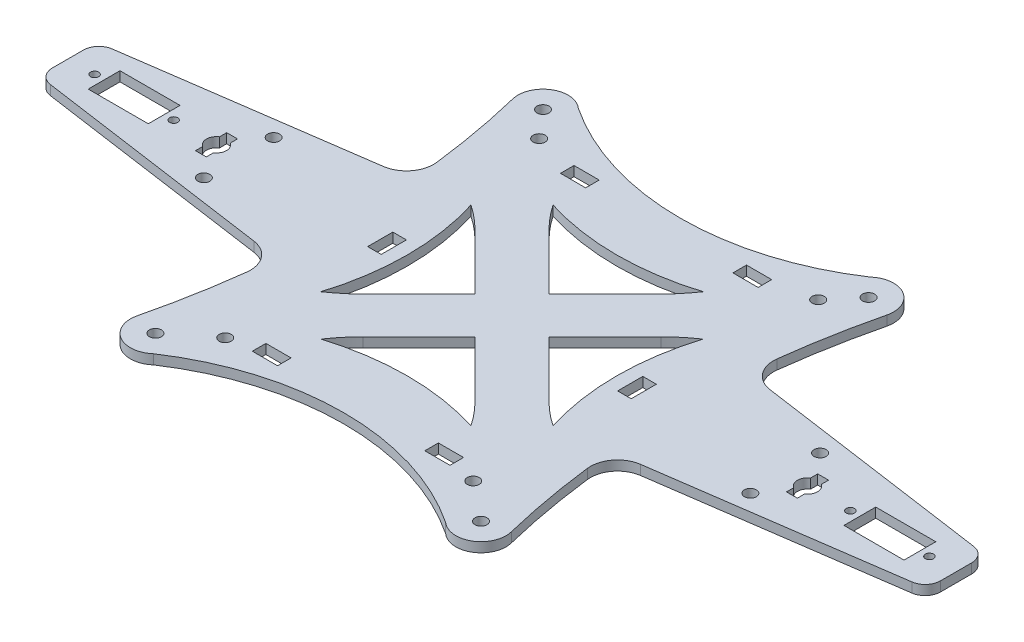
from build123d import *

# Parameters (mm, degrees)
SKETCH_1_R      = 1.55
SKETCH_1_R_2    = 1.05
SKETCH_1_W      = 6.5
SKETCH_1_H      = 3.5
SKETCH_1_W_2    = 3.5
SKETCH_1_H_2    = 6.5
SKETCH_1_W_3    = 15.5
SKETCH_1_H_3    = 8.2
EXTRUDE_1_DEPTH = 2.5
FILLET_1_R      = 4
FILLET_2_R      = 7


with BuildPart() as part:
    # 草图1 → 凸台-拉伸1 (new body)
    with BuildSketch(Plane(origin=(0, 0, 0), x_dir=(1, 0, 0), z_dir=(0, 1, 0))):
        with BuildLine():
            Line((114.591143215, 7.468307572), (114.591143215, -7.468307572))
            Line((114.591143215, -7.468307572), (43.193640968, -17.646273029))
            ThreePointArc((43.193640968, -17.646273029), (45.143245402, -33.15226541), (48.27557779, -48.463217404))
            ThreePointArc((48.27557779, -48.463217404), (45.335063646, -55.533708325), (37.709796983, -54.831018053))
            ThreePointArc((37.709796983, -54.831018053), (0, -43.436211003), (-37.709796983, -54.831018053))
            ThreePointArc((-37.709796983, -54.831018053), (-45.335063646, -55.533708325), (-48.27557779, -48.463217404))
            ThreePointArc((-48.27557779, -48.463217404), (-45.143245402, -33.15226541), (-43.193640968, -17.646273029))
            Line((-43.193640968, -17.646273029), (-114.591143215, -7.468307572))
            Line((-114.591143215, -7.468307572), (-114.591143215, 7.468307572))
            Line((-114.591143215, 7.468307572), (-43.193640968, 17.646273029))
            ThreePointArc((-43.193640968, 17.646273029), (-45.143245402, 33.15226541), (-48.27557779, 48.463217404))
            ThreePointArc((-48.27557779, 48.463217404), (-45.335063646, 55.533708325), (-37.709796983, 54.831018053))
            ThreePointArc((-37.709796983, 54.831018053), (0, 43.436211003), (37.709796983, 54.831018053))
            ThreePointArc((37.709796983, 54.831018053), (45.335063646, 55.533708325), (48.27557779, 48.463217404))
            ThreePointArc((48.27557779, 48.463217404), (45.143245402, 33.15226541), (43.193640968, 17.646273029))
            Line((43.193640968, 17.646273029), (114.591143215, 7.468307572))
        make_face()
        with Locations(Location((-36, 43, 0), (0, 0, 270))):
            Circle(SKETCH_1_R, mode=Mode.SUBTRACT)
        with Locations(Location((-32, -42, 0), (0, 0, 270))):
            Circle(SKETCH_1_R, mode=Mode.SUBTRACT)
        with Locations(Location((32, -42, 0), (0, 0, 90))):
            Circle(SKETCH_1_R, mode=Mode.SUBTRACT)
        with Locations(Location((36, 43, 0), (0, 0, 90))):
            Circle(SKETCH_1_R, mode=Mode.SUBTRACT)
        with Locations(Location((42, 50, 0), (0, 0, 270))):
            Circle(SKETCH_1_R, mode=Mode.SUBTRACT)
        with Locations(Location((42, -50, 0), (0, 0, 90))):
            Circle(SKETCH_1_R, mode=Mode.SUBTRACT)
        with Locations(Location((-42, -50, 0), (0, 0, 270))):
            Circle(SKETCH_1_R, mode=Mode.SUBTRACT)
        with Locations(Location((-42, 50, 0), (0, 0, 90))):
            Circle(SKETCH_1_R, mode=Mode.SUBTRACT)
        with Locations(Location((107.7, 0, 0), (0, 0, 270))):
            Circle(SKETCH_1_R_2, mode=Mode.SUBTRACT)
        with Locations(Location((87.3, 0, 0), (0, 0, 270))):
            Circle(SKETCH_1_R_2, mode=Mode.SUBTRACT)
        with Locations(Location((-87.3, 0, 0), (0, 0, 90))):
            Circle(SKETCH_1_R_2, mode=Mode.SUBTRACT)
        with Locations(Location((-107.7, 0, 0), (0, 0, 90))):
            Circle(SKETCH_1_R_2, mode=Mode.SUBTRACT)
        with Locations(Location((70.5, 9, 0), (0, 0, 270))):
            Circle(SKETCH_1_R, mode=Mode.SUBTRACT)
        with Locations(Location((70.5, -9, 0), (0, 0, 90))):
            Circle(SKETCH_1_R, mode=Mode.SUBTRACT)
        with Locations(Location((-70.5, -9, 0), (0, 0, 270))):
            Circle(SKETCH_1_R, mode=Mode.SUBTRACT)
        with Locations(Location((-70.5, 9, 0), (0, 0, 90))):
            Circle(SKETCH_1_R, mode=Mode.SUBTRACT)
        with Locations((-22.25, 39.75)):
            Rectangle(SKETCH_1_W, SKETCH_1_H, mode=Mode.SUBTRACT)
        with Locations((-32.25, 0)):
            Rectangle(SKETCH_1_W_2, SKETCH_1_H_2, mode=Mode.SUBTRACT)
        with Locations((-22.25, -39.75)):
            Rectangle(SKETCH_1_W, SKETCH_1_H, mode=Mode.SUBTRACT)
        with Locations((22.25, 39.75)):
            Rectangle(SKETCH_1_W, SKETCH_1_H, mode=Mode.SUBTRACT)
        with Locations((22.25, -39.75)):
            Rectangle(SKETCH_1_W, SKETCH_1_H, mode=Mode.SUBTRACT)
        with Locations((32.25, 0)):
            Rectangle(SKETCH_1_W_2, SKETCH_1_H_2, mode=Mode.SUBTRACT)
        with BuildLine():
            Line((77.65, -2.176778405), (77.65, -4.025))
            Line((77.65, -4.025), (74.85, -4.025))
            Line((74.85, -4.025), (74.85, -2.176778405))
            ThreePointArc((74.85, -2.176778405), (73.661880176, 0), (74.85, 2.176778405))
            Line((74.85, 2.176778405), (74.85, 4.025))
            Line((74.85, 4.025), (77.65, 4.025))
            Line((77.65, 4.025), (77.65, 2.176778405))
            ThreePointArc((77.65, 2.176778405), (78.838119824, 0), (77.65, -2.176778405))
        make_face(mode=Mode.SUBTRACT)
        with Locations((97.5, 0)):
            Rectangle(SKETCH_1_W_3, SKETCH_1_H_3, mode=Mode.SUBTRACT)
        with Locations((-97.5, 0)):
            Rectangle(SKETCH_1_W_3, SKETCH_1_H_3, mode=Mode.SUBTRACT)
        with BuildLine():
            Line((-74.85, -2.176778405), (-74.85, -4.025))
            Line((-74.85, -4.025), (-77.65, -4.025))
            Line((-77.65, -4.025), (-77.65, -2.176778405))
            ThreePointArc((-77.65, -2.176778405), (-78.838119824, 0), (-77.65, 2.176778405))
            Line((-77.65, 2.176778405), (-77.65, 4.025))
            Line((-77.65, 4.025), (-74.85, 4.025))
            Line((-74.85, 4.025), (-74.85, 2.176778405))
            ThreePointArc((-74.85, 2.176778405), (-73.661880176, 0), (-74.85, -2.176778405))
        make_face(mode=Mode.SUBTRACT)
        with BuildLine():
            Line((-23.978041684, 14.429581723), (-9.54845996, 0))
            Line((-9.54845996, 0), (-23.978041684, -14.429581723))
            ThreePointArc((-23.978041684, -14.429581723), (-26.851664039, -17.042325553), (-29.960234119, -19.370614155))
            ThreePointArc((-29.960234119, -19.370614155), (-27.006361348, 0), (-29.960234119, 19.370614155))
            ThreePointArc((-29.960234119, 19.370614155), (-26.851664039, 17.042325553), (-23.978041684, 14.429581723))
        make_face(mode=Mode.SUBTRACT)
        with BuildLine():
            Line((14.429581723, 23.978041684), (0, 9.54845996))
            Line((0, 9.54845996), (-14.429581723, 23.978041684))
            ThreePointArc((-14.429581723, 23.978041684), (-17.042325553, 26.851664039), (-19.370614155, 29.960234119))
            ThreePointArc((-19.370614155, 29.960234119), (0, 27.006361348), (19.370614155, 29.960234119))
            ThreePointArc((19.370614155, 29.960234119), (17.042325553, 26.851664039), (14.429581723, 23.978041684))
        make_face(mode=Mode.SUBTRACT)
        with BuildLine():
            Line((23.978041684, -14.429581723), (9.54845996, 0))
            Line((9.54845996, 0), (23.978041684, 14.429581723))
            ThreePointArc((23.978041684, 14.429581723), (26.851664039, 17.042325553), (29.960234119, 19.370614155))
            ThreePointArc((29.960234119, 19.370614155), (27.006361348, 0), (29.960234119, -19.370614155))
            ThreePointArc((29.960234119, -19.370614155), (26.851664039, -17.042325553), (23.978041684, -14.429581723))
        make_face(mode=Mode.SUBTRACT)
        with BuildLine():
            Line((-14.429581723, -23.978041684), (0, -9.54845996))
            Line((0, -9.54845996), (14.429581723, -23.978041684))
            ThreePointArc((14.429581723, -23.978041684), (17.042325553, -26.851664039), (19.370614155, -29.960234119))
            ThreePointArc((19.370614155, -29.960234119), (0, -27.006361348), (-19.370614155, -29.960234119))
            ThreePointArc((-19.370614155, -29.960234119), (-17.042325553, -26.851664039), (-14.429581723, -23.978041684))
        make_face(mode=Mode.SUBTRACT)
    extrude(amount=EXTRUDE_1_DEPTH)

    # 圆角1
    fillet_1_edges = [part.edges().sort_by_distance(p)[0] for p in [
        (-114.591143215, 1.25, 7.468307572),
        (-114.591143215, 1.25, -7.468307572),
        (114.591143215, 1.25, -7.468307572),
        (114.591143215, 1.25, 7.468307572),
    ]]
    fillet(fillet_1_edges, radius=FILLET_1_R)

    # 圆角2
    fillet_2_edges = [part.edges().sort_by_distance(p)[0] for p in [
        (-43.193640968, 1.25, 17.646273029),
        (-43.193640968, 1.25, -17.646273029),
        (43.193640968, 1.25, -17.646273029),
        (43.193640968, 1.25, 17.646273029),
    ]]
    fillet(fillet_2_edges, radius=FILLET_2_R)


solid = part.part
